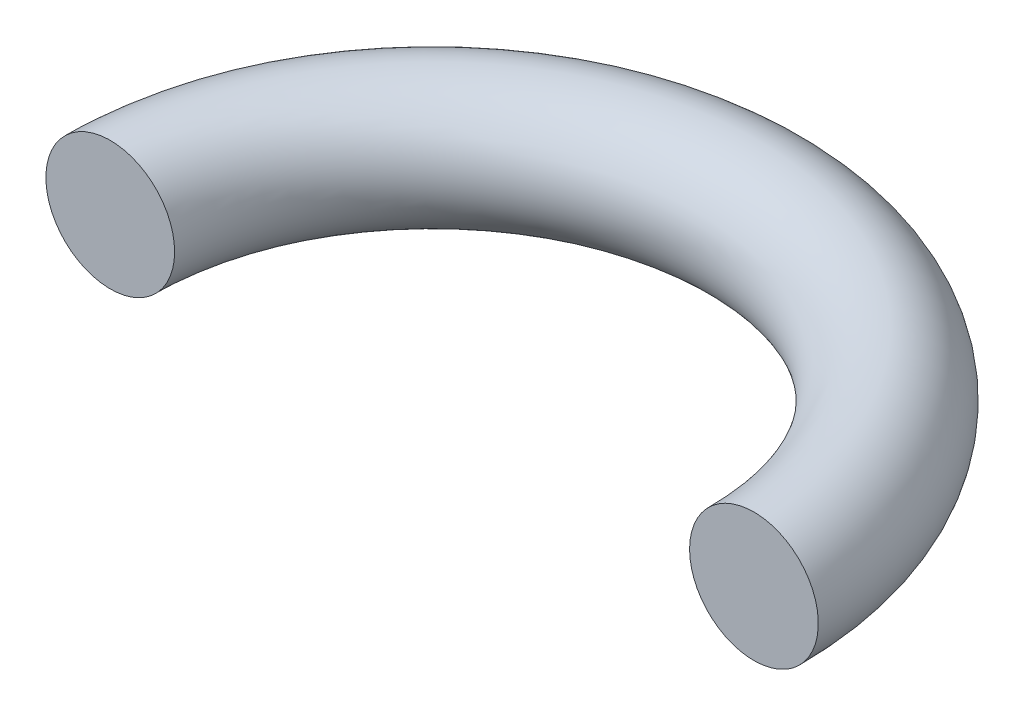
from build123d import *

# Parameters (mm, degrees)
SKETCH2_R = 1


with BuildPart() as part:
    # Sweep1: sweep along a path in Sketch1
    with BuildLine(Plane(origin=(0, 0, 0), x_dir=(1, 0, 0), z_dir=(0, 1, 0))) as sweep1_path:
        ThreePointArc((5, 0), (0, 5), (-5, 0))
    # Sketch2 → Sweep1 (sweep)
    with BuildSketch(Plane.XY):
        with Locations((-5, 0)):
            Circle(SKETCH2_R)
    sweep(path=sweep1_path.line)


solid = part.part
